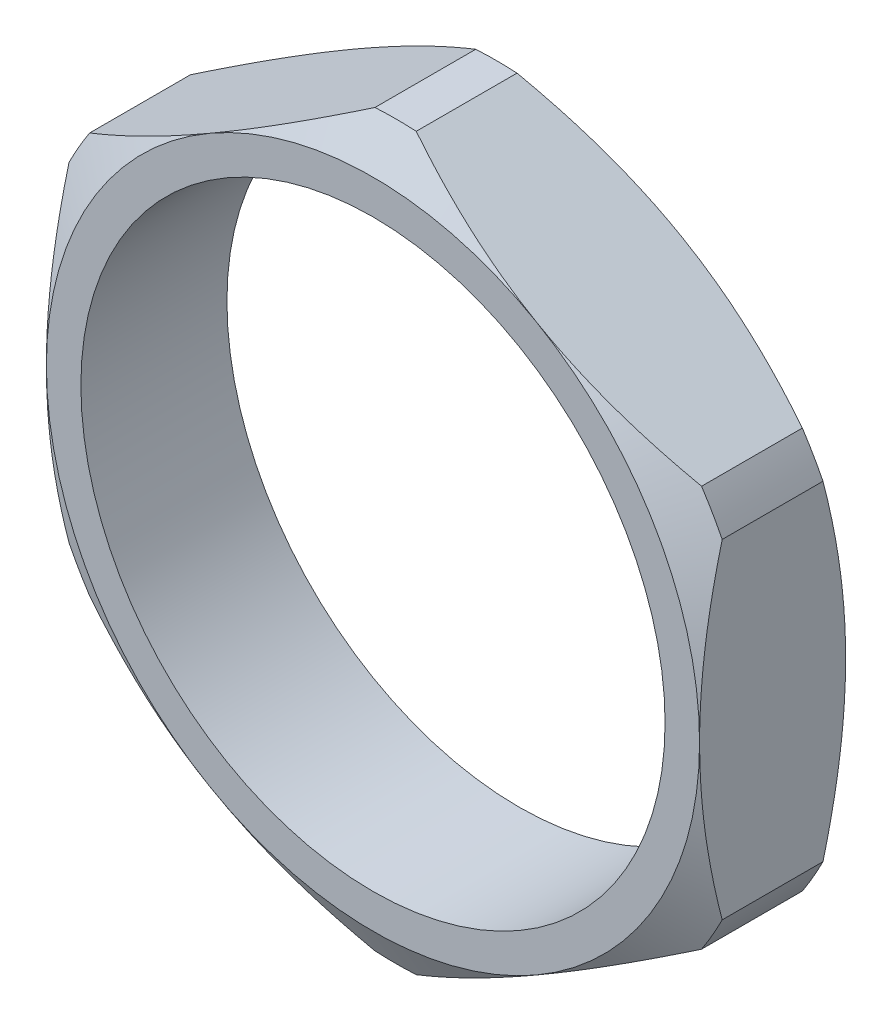
from build123d import *

# Parameters (mm, degrees)
CUT_EXTRUDE1_DEPTH      = 12.357322055
CUT_EXTRUDE1_DEPTH_BACK = 12.357322055
SKETCH4_OUTSIDE_W       = 22.446
SKETCH4_OUTSIDE_H       = 22.446


with BuildPart() as part:
    # Sketch3 → Revolve1 (revolve)
    with BuildSketch(Plane(origin=(0, 0, 0), x_dir=(0, 0, -1), z_dir=(1, 0, 0))):
        Polygon((-1.5875, 7.1), (-1.095597571, 7.952), (1.095597571, 7.952), (1.5875, 7.1), (1.5875, 6.35), (-1.5875, 6.35), align=None)
    revolve(axis=Axis((0, 0, 1.5875), (0, 0, -1)))

    # Sketch4 outside → Cut-Extrude1 (cut, two sides: drawn at the far end of the back side and taken through both)
    with BuildSketch(Plane.XY.offset(-CUT_EXTRUDE1_DEPTH_BACK)):
        Rectangle(SKETCH4_OUTSIDE_W, SKETCH4_OUTSIDE_H)
        Polygon((0, 8.198373822), (-7.1, 4.099186911), (-7.1, -4.099186911), (0, -8.198373822), (7.1, -4.099186911), (7.1, 4.099186911), align=None, mode=Mode.SUBTRACT)
    extrude(amount=CUT_EXTRUDE1_DEPTH + CUT_EXTRUDE1_DEPTH_BACK, mode=Mode.SUBTRACT)


solid = part.part
